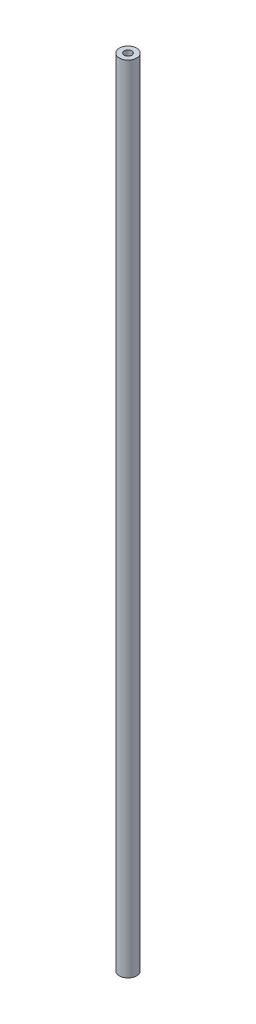
from build123d import *

# Parameters (mm, degrees)
SKETCH1_R           = 0.25
SKETCH1_R_2         = 0.11
BOSS_EXTRUDE1_DEPTH = 23


with BuildPart() as part:
    # Sketch1 → Boss-Extrude1 (new body)
    with BuildSketch(Plane(origin=(0, 0, 0), x_dir=(1, 0, 0), z_dir=(0, 1, 0))):
        with Locations(Location((0, 0, 0), (0, 0, 270))):
            Circle(SKETCH1_R)
        with Locations(Location((0, 0, 0), (0, 0, 270))):
            Circle(SKETCH1_R_2, mode=Mode.SUBTRACT)
    extrude(amount=BOSS_EXTRUDE1_DEPTH)


solid = part.part
